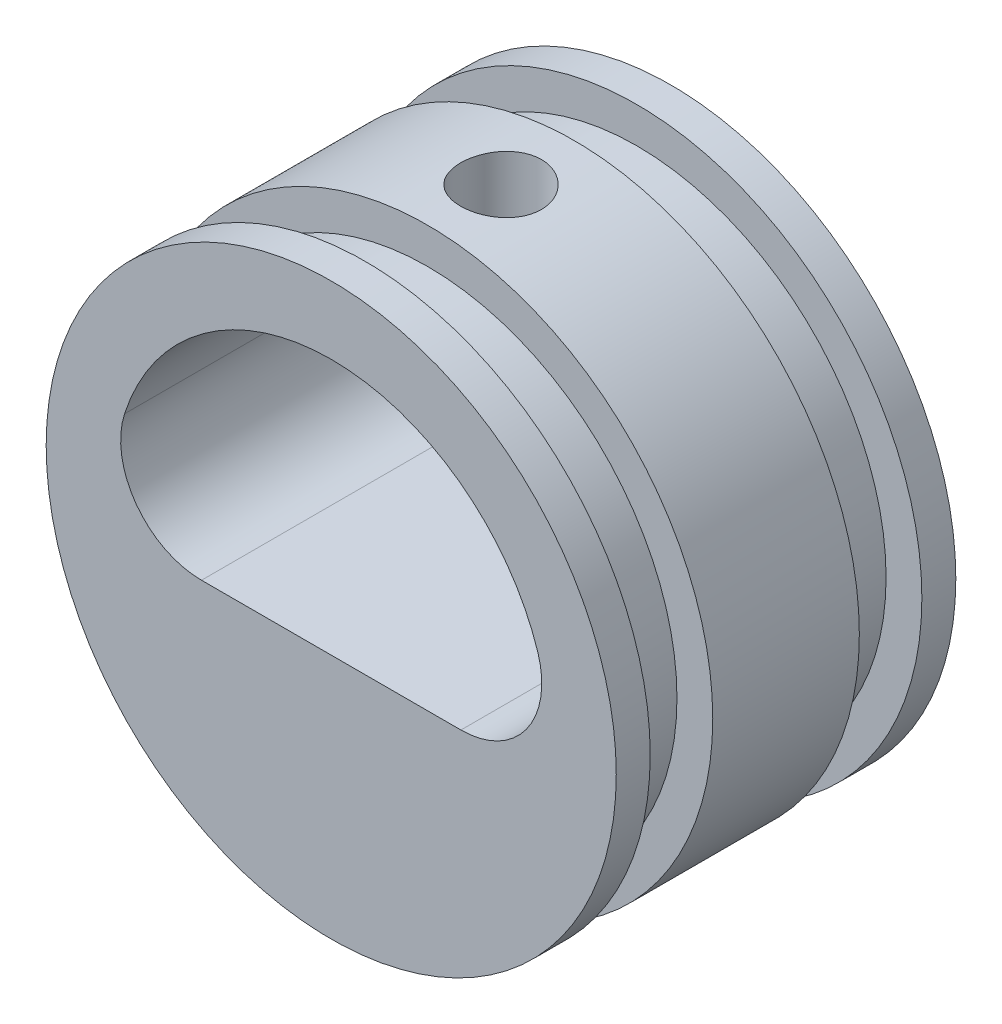
from build123d import *

# Parameters (mm, degrees)
SKETCH1_R                          = 16.7894
BOSS_EXTRUDE1_DEPTH                = 20
SKETCH2_W                          = 3.683
SKETCH2_H                          = 2.1082
CUT_EXTRUDE1_DEPTH                 = 32.044611525
FILLET1_R                          = 4.7625
F_3_16_0_1875_DIAMETER_HOLE1_D     = 4.7625
F_3_16_0_1875_DIAMETER_HOLE1_DEPTH = 11.543700016
F_3_16_0_1875_DIAMETER_HOLE1_TIP   = 1.430799349


with BuildPart() as part:
    # Sketch1 → Boss-Extrude1 (new body)
    with BuildSketch(Plane.XY):
        Circle(SKETCH1_R)
    extrude(amount=BOSS_EXTRUDE1_DEPTH)

    # Sketch2 → Cut-Revolve1 (revolve, cut)
    with BuildSketch(Plane(origin=(0, 0, 0), x_dir=(0, 0, -1), z_dir=(1, 0, 0)), mode=Mode.PRIVATE) as cut_revolve1_sk:
        with Locations((-16.1585, 15.7353)):
            Rectangle(SKETCH2_W, SKETCH2_H)
        with Locations((-3.8415, 15.7353)):
            Rectangle(SKETCH2_W, SKETCH2_H)
    revolve(cut_revolve1_sk.sketch.rotate(Axis((0, 0, 21.240749408), (0, 0, -1)), 90), axis=Axis((0, 0, 21.240749408), (0, 0, -1)), mode=Mode.SUBTRACT)

    # Sketch3 → Cut-Extrude1 (cut, through all)
    with BuildSketch(Plane.XY.offset(20)):
        with BuildLine():
            Line((-12.580888371, -2.300000032), (12.580888371, -2.300000032))
            ThreePointArc((12.580888371, -2.300000032), (0, 12.7894), (-12.580888371, -2.300000032))
        make_face()
    extrude(amount=-CUT_EXTRUDE1_DEPTH, mode=Mode.SUBTRACT)

    # Fillet1
    fillet1_edges = [part.edges().sort_by_distance(p)[0] for p in [
        (-12.580888371, -2.300000032, 10),
        (12.580888371, -2.300000032, 10),
    ]]
    fillet(fillet1_edges, radius=FILLET1_R)

    # 3/16 (0.1875) Diameter Hole1
    with Locations(Plane(origin=(0, 16.7894, 0), x_dir=(-1, 0, 0), z_dir=(0, 1, 0))):
        with Locations((0, 10)):
            Hole(F_3_16_0_1875_DIAMETER_HOLE1_D / 2, depth=F_3_16_0_1875_DIAMETER_HOLE1_DEPTH)
            with Locations((0, 0, -(F_3_16_0_1875_DIAMETER_HOLE1_DEPTH + F_3_16_0_1875_DIAMETER_HOLE1_TIP / 2))):  # 118° drill point
                Cone(0, F_3_16_0_1875_DIAMETER_HOLE1_D / 2, F_3_16_0_1875_DIAMETER_HOLE1_TIP, mode=Mode.SUBTRACT)


solid = part.part
